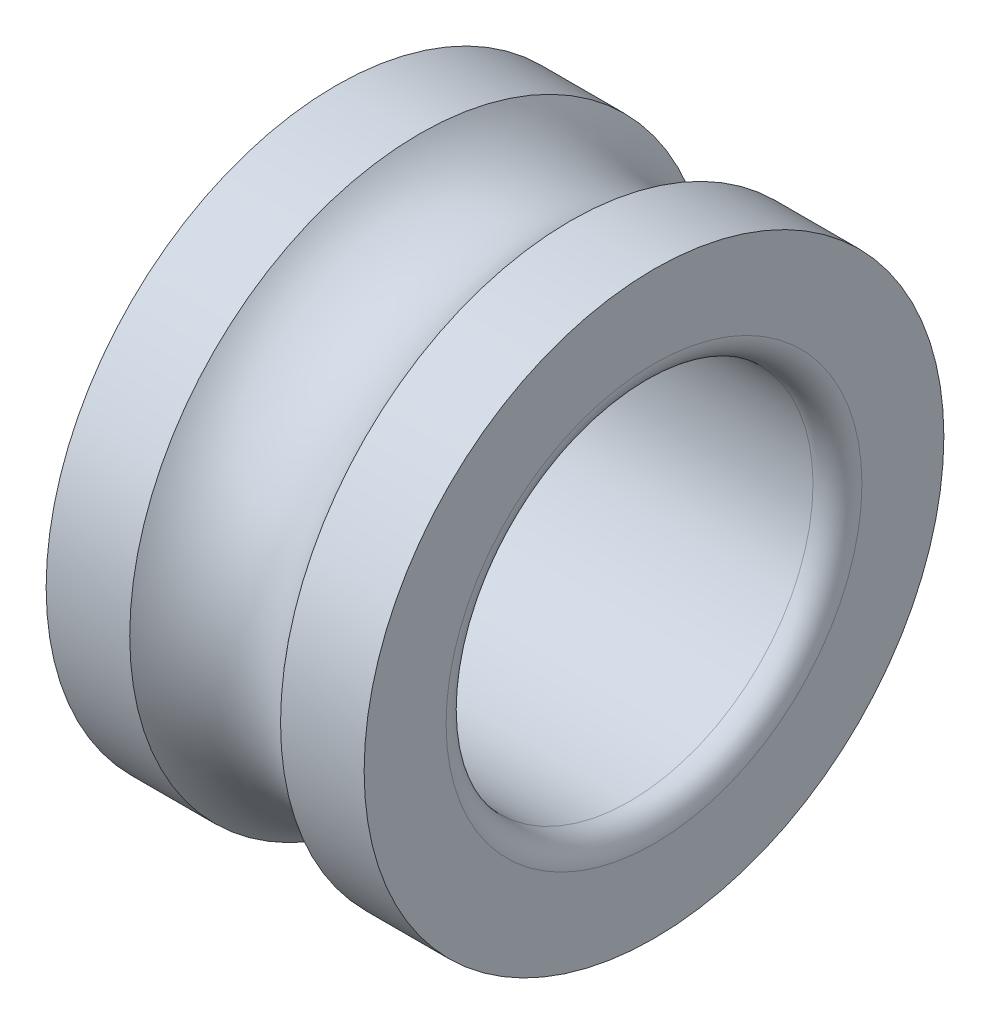
from build123d import *


with BuildPart() as part:
    # Sketch1 → Revolução1 (revolve)
    with BuildSketch(Plane.XY, mode=Mode.PRIVATE) as revolu_o1_sk:
        with BuildLine():
            Line((1, 7.5), (12, 7.5))
            ThreePointArc((12, 7.5), (12.707106781, 7.792893219), (13, 8.5))
            Line((13, 8.5), (13, 11.85))
            Line((13, 11.85), (9.582687302, 11.85))
            ThreePointArc((9.582687302, 11.85), (6.5, 10.381), (3.417312698, 11.85))
            Line((3.417312698, 11.85), (0, 11.85))
            Line((0, 11.85), (0, 8.5))
            ThreePointArc((0, 8.5), (0.292893219, 7.792893219), (1, 7.5))
        make_face()
    revolve(revolu_o1_sk.sketch.rotate(Axis((50, 0, 0), (-1, 0, 0)), 270), axis=Axis((50, 0, 0), (-1, 0, 0)))


solid = part.part
